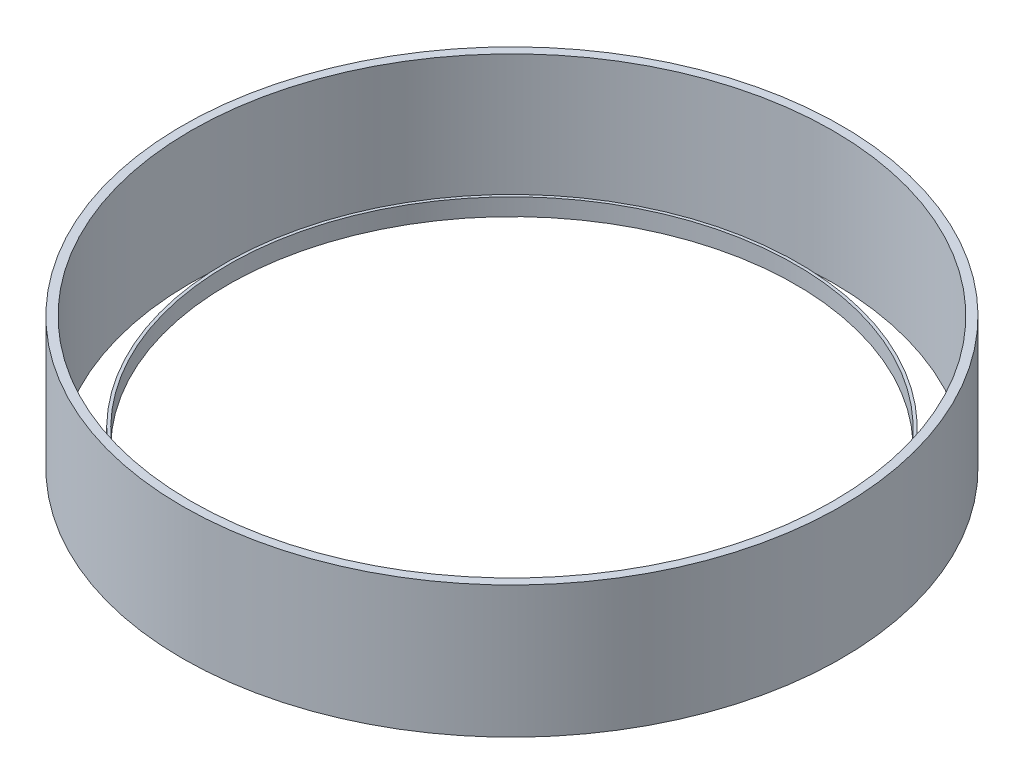
from build123d import *

# Parameters (mm, degrees)
SKETCH27_R                = 50
SKETCH27_R_2              = 49.5
BOSS_EXTRUDE10_DEPTH      = 3
BOSS_EXTRUDE11_DEPTH      = 20
BOSS_EXTRUDE11_DEPTH_BACK = 3
SKETCH28_R                = 57.5
SKETCH28_R_2              = 56


with BuildPart() as part:
    # Sketch27 → Boss-Extrude10 (new body)
    with BuildSketch(Plane(origin=(0, 0, 0), x_dir=(1, 0, 0), z_dir=(0, 1, 0))):
        Circle(SKETCH27_R)
        Circle(SKETCH27_R_2, mode=Mode.SUBTRACT)
    extrude(amount=BOSS_EXTRUDE10_DEPTH)


with BuildPart() as body_2:
    # Sketch28 → Boss-Extrude11 (new, two sides: drawn at the far end of the back side and taken through both)
    with BuildSketch(Plane(origin=(0, 0, 0), x_dir=(1, 0, 0), z_dir=(0, 1, 0)).offset(-BOSS_EXTRUDE11_DEPTH_BACK)):
        Circle(SKETCH28_R)
        Circle(SKETCH28_R_2, mode=Mode.SUBTRACT)
    extrude(amount=BOSS_EXTRUDE11_DEPTH + BOSS_EXTRUDE11_DEPTH_BACK)


solid = Compound([part.part, body_2.part])
